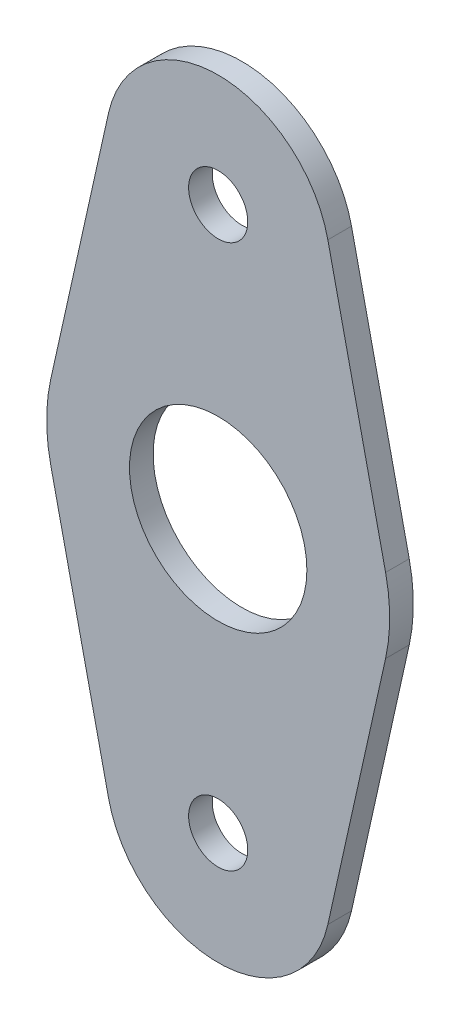
from build123d import *

# Parameters (mm, degrees)
SKETCH1_R           = 7.5
SKETCH1_R_2         = 2.5
BOSS_EXTRUDE1_DEPTH = 1


with BuildPart() as part:
    # Sketch1 → Boss-Extrude1 (new, symmetric)
    with BuildSketch(Plane.XY):
        with BuildLine():
            Line((-9.272803089, 25.065217391), (-14.153225767, 3.152173913))
            ThreePointArc((-14.153225767, 3.152173913), (-14.5, 0), (-14.153225767, -3.152173913))
            Line((-14.153225767, -3.152173913), (-9.272803089, -25.065217391))
            ThreePointArc((-9.272803089, -25.065217391), (0, -32.5), (9.272803089, -25.065217391))
            Line((9.272803089, -25.065217391), (14.153225767, -3.152173913))
            ThreePointArc((14.153225767, -3.152173913), (14.5, 0), (14.153225767, 3.152173913))
            Line((14.153225767, 3.152173913), (9.272803089, 25.065217391))
            ThreePointArc((9.272803089, 25.065217391), (0, 32.5), (-9.272803089, 25.065217391))
        make_face()
        Circle(SKETCH1_R, mode=Mode.SUBTRACT)
        with Locations((0, 23)):
            Circle(SKETCH1_R_2, mode=Mode.SUBTRACT)
        with Locations(Location((0, -23, 0), (0, 0, 180))):
            Circle(SKETCH1_R_2, mode=Mode.SUBTRACT)
    extrude(amount=BOSS_EXTRUDE1_DEPTH, both=True)


solid = part.part
